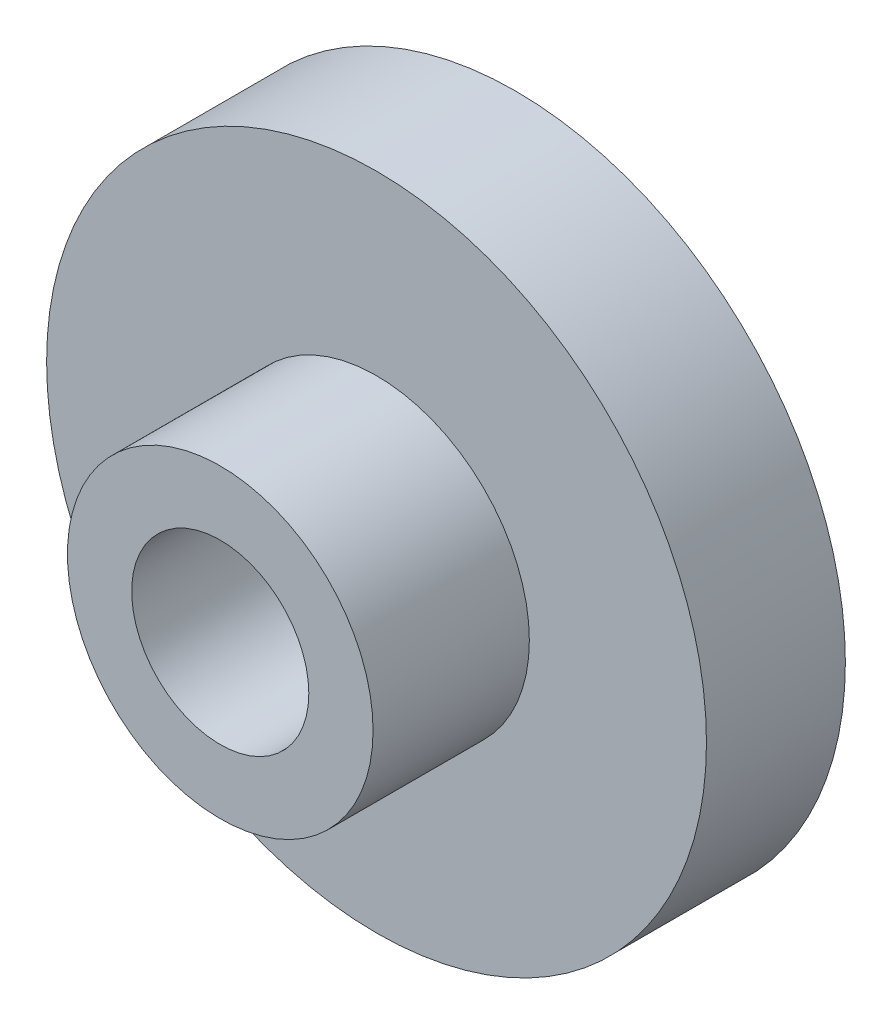
from build123d import *

# Parameters (mm, degrees)
SKETCH1_R             = 4.75
SKETCH1_R_2           = 2.2
BOSS_EXTRUDE1_DEPTH   = 2
SKETCH1_R_3           = 1.275
BOSS_EXTRUDE1_2_DEPTH = 2
SKETCH1_3_R           = 2.2
SKETCH1_3_R_2         = 1.275
BOSS_EXTRUDE2_DEPTH   = 4.25


with BuildPart() as part:
    # Sketch1 → Boss-Extrude1 (new body)
    with BuildSketch(Plane.XY):
        Circle(SKETCH1_R)
        Circle(SKETCH1_R_2, mode=Mode.SUBTRACT)
    extrude(amount=BOSS_EXTRUDE1_DEPTH)



with BuildPart() as body_2:
    # Sketch1 → Boss-Extrude1 2 (new body)
    with BuildSketch(Plane.XY):
        Circle(SKETCH1_R_3)
    extrude(amount=BOSS_EXTRUDE1_2_DEPTH)


with BuildPart() as part_1:
    add(part.part)

    add(body_2.part)  # Boss-Extrude2 merges body 2
    # Sketch1<3> → Boss-Extrude2 (add)
    with BuildSketch(Plane.XY):
        Circle(SKETCH1_3_R)
        Circle(SKETCH1_3_R_2, mode=Mode.SUBTRACT)
    extrude(amount=BOSS_EXTRUDE2_DEPTH)


solid = part_1.part
